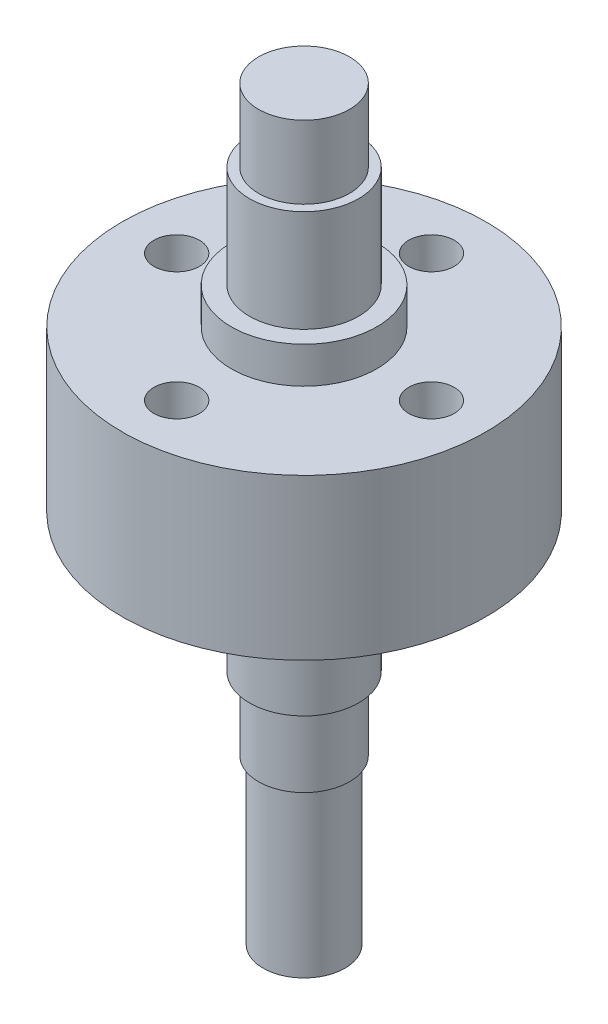
from build123d import *

# Parameters (mm, degrees)
HOLE_WIZARD_M3_1_D       = 2.5
PATTERN_CIRCULAR_1_COUNT = 4
SKETCH_5_R               = 2.25
EXTRUDE_1_DEPTH          = 9
HOLE_WIZARD_M3_2_D       = 2.5
HOLE_WIZARD_M3_2_DEPTH   = 12
HOLE_WIZARD_M3_2_TIP     = 0.751075774


with BuildPart() as part:
    # Model → 旋转1 (revolve)
    with BuildSketch(Plane.XY, mode=Mode.PRIVATE) as revolve_1_sk:
        Polygon((0, 32), (0, 0), (2.5, 0), (2.5, 4), (3, 4), (3, 9.6), (4, 9.6), (4, 11.6), (10, 11.6), (10, 20.4), (4, 20.4), (4, 22.4), (3, 22.4), (3, 28), (2.5, 28), (2.5, 32), align=None)
    revolve(revolve_1_sk.sketch.rotate(Axis((0, 32, 0), (0, -1, 0)), 180), axis=Axis((0, 32, 0), (0, -1, 0)))

    # M3 螺纹孔1 (through all)
    with Locations(Plane(origin=(0, 11.6, 7), x_dir=(-1, 0, 0), z_dir=(0, -1, 0))):
        with Locations((0, 0)):
            hole_wizard_m3_1 = Hole(HOLE_WIZARD_M3_1_D / 2)

    # 阵列(圆周)1: M3 螺纹孔1 ×4 about axis
    pattern_circular_1_axis = Axis((0, 0, 0), (0, 1, 0))
    for i in range(1, PATTERN_CIRCULAR_1_COUNT):
        add(hole_wizard_m3_1.rotate(pattern_circular_1_axis, i * 360 / PATTERN_CIRCULAR_1_COUNT), mode=Mode.SUBTRACT)

    # 草图5 → 凸台-拉伸1 (add)
    with BuildSketch(Plane.XZ):
        Circle(SKETCH_5_R)
    extrude(amount=EXTRUDE_1_DEPTH)

    # M3 螺纹孔2
    with Locations(Plane(origin=(0, -9, 0), x_dir=(-1, 0, 0), z_dir=(0, -1, 0))):
        with Locations((0, 0)):
            Hole(HOLE_WIZARD_M3_2_D / 2, depth=HOLE_WIZARD_M3_2_DEPTH)
            with Locations((0, 0, -(HOLE_WIZARD_M3_2_DEPTH + HOLE_WIZARD_M3_2_TIP / 2))):  # 118° drill point
                Cone(0, HOLE_WIZARD_M3_2_D / 2, HOLE_WIZARD_M3_2_TIP, mode=Mode.SUBTRACT)


solid = part.part
